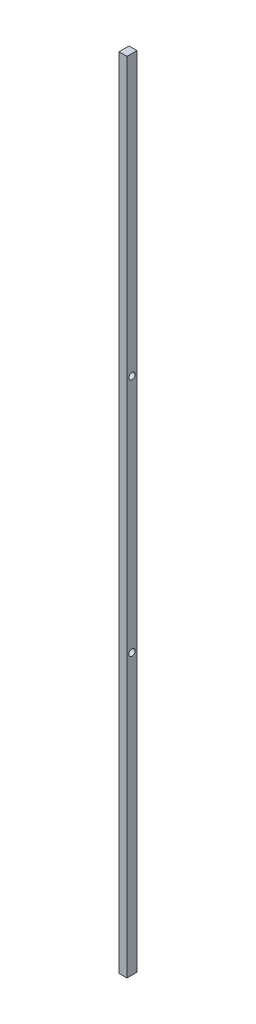
from build123d import *

# Parameters (mm, degrees)
SKETCH_1_W          = 4
SKETCH_1_H          = 5
EXTRUDE_1_DEPTH     = 400
SKETCH_2_R          = 1.6
CUT_EXTRUDE_1_DEPTH = 400


with BuildPart() as part:
    # 草图1 → 凸台-拉伸1 (new body)
    with BuildSketch(Plane(origin=(0, 0, 0), x_dir=(1, 0, 0), z_dir=(0, 1, 0))):
        with Locations((2, 2.5)):
            Rectangle(SKETCH_1_W, SKETCH_1_H)
    extrude(amount=EXTRUDE_1_DEPTH)

    # 草图2 → 切除-拉伸1 (cut)
    with BuildSketch(Plane(origin=(4, 0, 0), x_dir=(0, 0, -1), z_dir=(1, 0, 0))):
        with Locations((2.5, 140)):
            Circle(SKETCH_2_R)
        with Locations((2.5, 260)):
            Circle(SKETCH_2_R)
    extrude(amount=-CUT_EXTRUDE_1_DEPTH, mode=Mode.SUBTRACT)


solid = part.part
